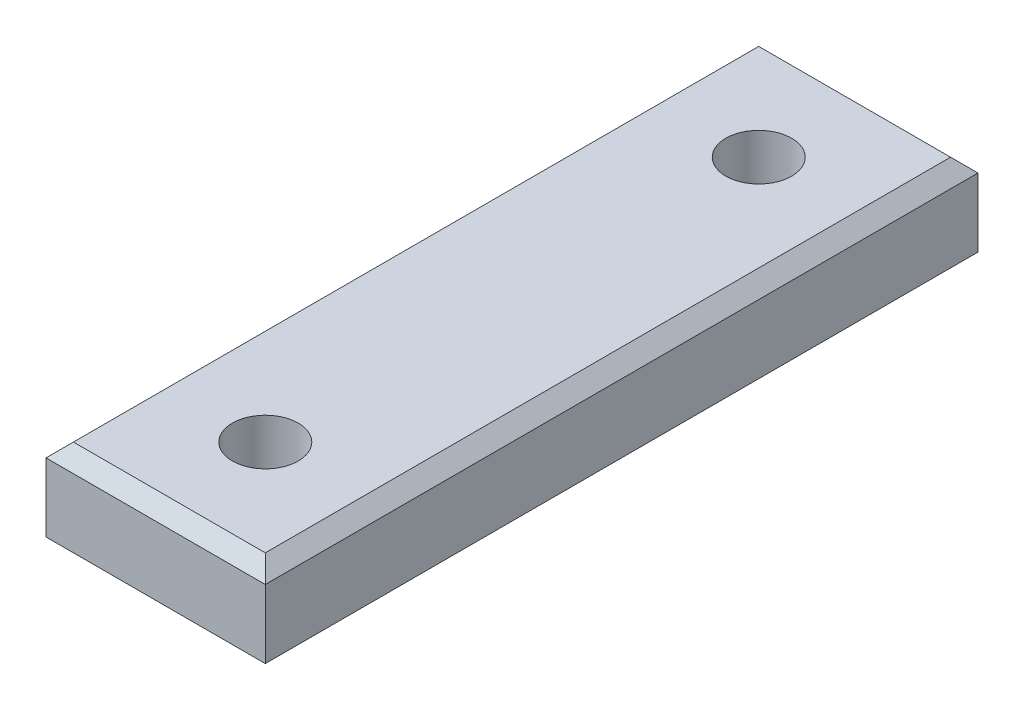
from build123d import *

# Parameters (mm, degrees)
SKETCH1_W               = 8
SKETCH1_H               = 3.5
BOSS_EXTRUDE1_DEPTH     = 5
SKETCH2_W               = 8
SKETCH2_H               = 3.5
BOSS_EXTRUDE2_DEPTH     = 8
CHAMFER1_SIZE           = 0.5
CUT_EXTRUDE1_DEPTH      = 15.044571905
CUT_EXTRUDE1_DEPTH_BACK = 15.044571905
SKETCH3_R               = 1.2


with BuildPart() as part:
    # Sketch1 → Boss-Extrude1 (new, symmetric)
    with BuildSketch(Plane.XY):
        Rectangle(SKETCH1_W, SKETCH1_H)
    extrude(amount=BOSS_EXTRUDE1_DEPTH, both=True)

    # Sketch2 → Boss-Extrude2 (add)
    with BuildSketch(Plane(origin=(0, 0, -5), x_dir=(-1, 0, 0), z_dir=(0, 0, -1))):
        Rectangle(SKETCH2_W, SKETCH2_H)
    boss_extrude2 = extrude(amount=BOSS_EXTRUDE2_DEPTH)

    # Mirror1: Boss-Extrude2 across plane
    add(boss_extrude2.mirror(Plane.XY))

    # Chamfer1
    chamfer1_edges = [part.edges().sort_by_distance(p)[0] for p in [
        (0, 1.75, -13),
        (0, -1.75, -13),
        (0, -1.75, 13),
        (0, 1.75, 13),
        (4, -1.75, 0),
        (-4, -1.75, 0),
        (-4, 1.75, 0),
        (4, 1.75, 0),
    ]]
    chamfer(chamfer1_edges, length=CHAMFER1_SIZE)

    # Sketch3 → Cut-Extrude1 (cut, two sides: drawn at the far end of the back side and taken through both)
    with BuildSketch(Plane(origin=(0, 1.75, 0), x_dir=(1, 0, 0), z_dir=(0, 1, 0)).offset(-CUT_EXTRUDE1_DEPTH_BACK)):
        with Locations(Location((0, -9, 0), (0, 0, 270))):
            Circle(SKETCH3_R)
        with Locations(Location((0, 9, 0), (0, 0, 270))):
            Circle(SKETCH3_R)
    extrude(amount=CUT_EXTRUDE1_DEPTH + CUT_EXTRUDE1_DEPTH_BACK, mode=Mode.SUBTRACT)


solid = part.part
